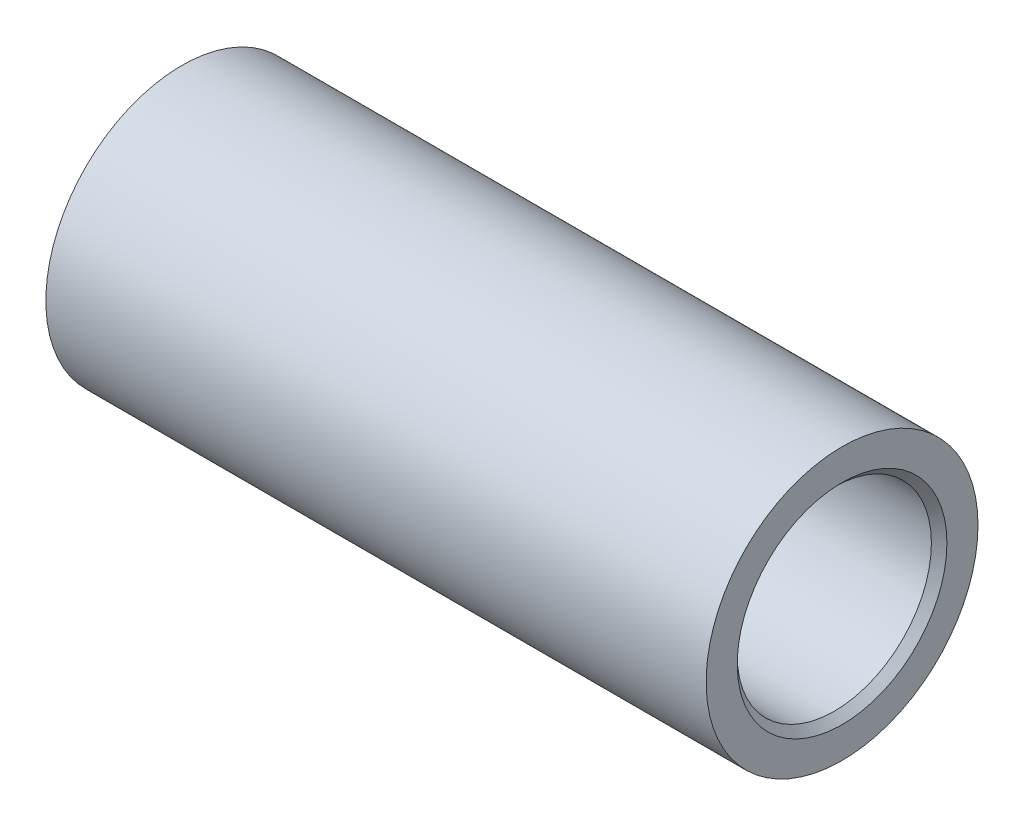
from build123d import *

# Parameters (mm, degrees)
SZKIC1_R                    = 17.5
SZKIC1_R_2                  = 12.5
DODANIE_WYCI_GNI_CIE1_DEPTH = 85
SFAZOWANIE1_SIZE            = 1


with BuildPart() as part:
    # Szkic1 → Dodanie-wyciągnięcie1 (new body)
    with BuildSketch(Plane(origin=(0, 0, 0), x_dir=(0, 0, -1), z_dir=(1, 0, 0))):
        Circle(SZKIC1_R)
        Circle(SZKIC1_R_2, mode=Mode.SUBTRACT)
    extrude(amount=DODANIE_WYCI_GNI_CIE1_DEPTH)

    # Sfazowanie1
    sfazowanie1_edges = [part.edges().sort_by_distance(p)[0] for p in [
        (0, 0, 12.5),
        (85, 0, 12.5),
    ]]
    chamfer(sfazowanie1_edges, length=SFAZOWANIE1_SIZE)


solid = part.part
